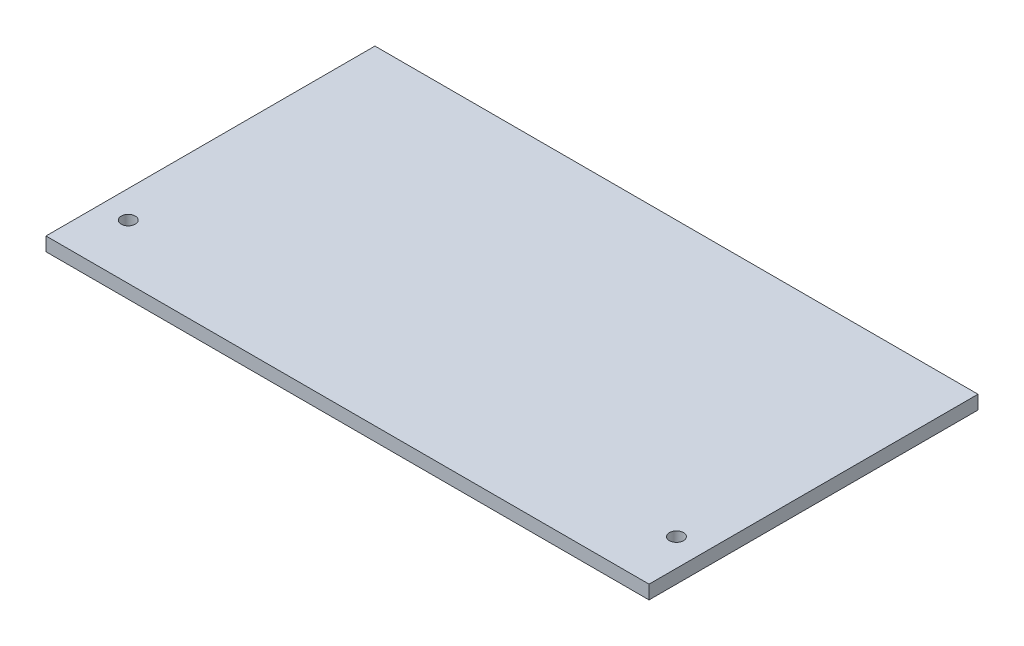
from build123d import *

# Parameters (mm, degrees)
SKETCH1_W                = 279.4
SKETCH1_H                = 152.4
BOSS_EXTRUDE1_DEPTH      = 6.35
F_0_257_DIAMETER_HOLE1_D = 6.5278


with BuildPart() as part:
    # Sketch1 → Boss-Extrude1 (new body)
    with BuildSketch(Plane(origin=(0, 0, 0), x_dir=(1, 0, 0), z_dir=(0, 1, 0))):
        Rectangle(SKETCH1_W, SKETCH1_H)
    extrude(amount=BOSS_EXTRUDE1_DEPTH)

    # F (0.257) Diameter Hole1 (through all)
    with Locations(Plane(origin=(0, 6.35, 0), x_dir=(1, 0, 0), z_dir=(0, 1, 0))):
        with Locations((-127, -50.8), (127, -50.8)):
            Hole(F_0_257_DIAMETER_HOLE1_D / 2)


solid = part.part
